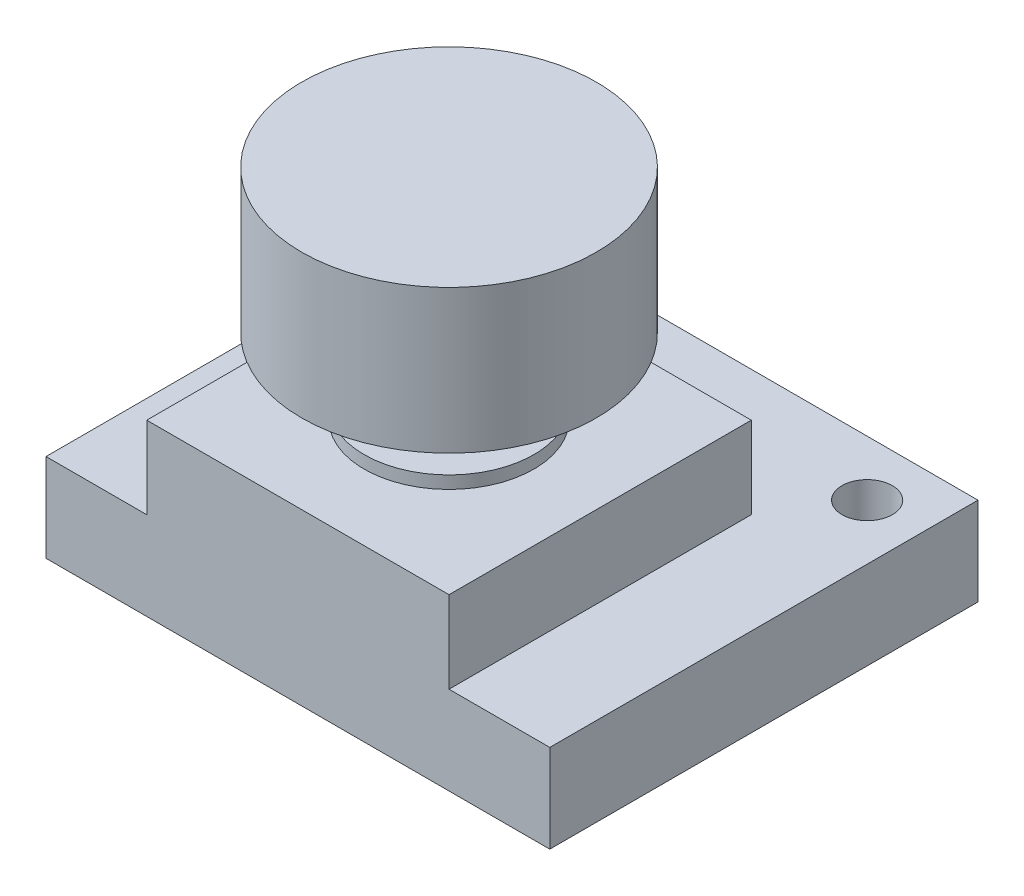
from build123d import *

# Parameters (mm, degrees)
SKETCH2_W           = 12
SKETCH2_H           = 12
BOSS_EXTRUDE1_DEPTH = 3.25
SKETCH3_R           = 3.37
SKETCH3_W           = 3
SKETCH3_H           = 3
BOSS_EXTRUDE2_DEPTH = 0.5
SKETCH3_4_W         = 3
SKETCH3_4_H         = 3
BOSS_EXTRUDE3_DEPTH = 4
BOSS_EXTRUDE4_START = 2
SKETCH3_5_W         = 3.8
SKETCH3_5_H         = 3.8
SKETCH3_5_W_2       = 3
SKETCH3_5_H_2       = 3
BOSS_EXTRUDE4_DEPTH = 2
SKETCH4_W           = 20
SKETCH4_H           = 17
SKETCH4_R           = 1
BOSS_EXTRUDE5_DEPTH = 3.5
BOSS_EXTRUDE6_START = 3
SKETCH7_R           = 5.85
BOSS_EXTRUDE6_DEPTH = 5.7


with BuildPart() as part:
    # Sketch2 → Boss-Extrude1 (new body)
    with BuildSketch(Plane(origin=(0, 0, 0), x_dir=(1, 0, 0), z_dir=(0, 1, 0))):
        Rectangle(SKETCH2_W, SKETCH2_H)
    extrude(amount=BOSS_EXTRUDE1_DEPTH)

    # Sketch3 → Boss-Extrude2 (add)
    with BuildSketch(Plane(origin=(0, 3.25, 0), x_dir=(1, 0, 0), z_dir=(0, 1, 0))):
        Circle(SKETCH3_R)
        Rectangle(SKETCH3_W, SKETCH3_H, mode=Mode.SUBTRACT)
    extrude(amount=BOSS_EXTRUDE2_DEPTH)

    # Sketch3<4> → Boss-Extrude3 (add)
    with BuildSketch(Plane(origin=(0, 3.25, 0), x_dir=(1, 0, 0), z_dir=(0, 1, 0))):
        Rectangle(SKETCH3_4_W, SKETCH3_4_H)
    extrude(amount=BOSS_EXTRUDE3_DEPTH)

    # Sketch3<5> → Boss-Extrude4 (add)
    with BuildSketch(Plane(origin=(0, 3.25, 0), x_dir=(1, 0, 0), z_dir=(0, 1, 0)).offset(BOSS_EXTRUDE4_START)):
        Rectangle(SKETCH3_5_W, SKETCH3_5_H)
        Rectangle(SKETCH3_5_W_2, SKETCH3_5_H_2, mode=Mode.SUBTRACT)
    extrude(amount=BOSS_EXTRUDE4_DEPTH)

    # Sketch4 → Boss-Extrude5 (add)
    with BuildSketch(Plane.XZ):
        with Locations((0, -2.5)):
            Rectangle(SKETCH4_W, SKETCH4_H)
        with Locations((-7.8, -8.8)):
            Circle(SKETCH4_R, mode=Mode.SUBTRACT)
        with Locations((7.8, -8.8)):
            Circle(SKETCH4_R, mode=Mode.SUBTRACT)
    extrude(amount=BOSS_EXTRUDE5_DEPTH)

    # Sketch7 → Boss-Extrude6 (add)
    with BuildSketch(Plane(origin=(0, 3.25, 0), x_dir=(1, 0, 0), z_dir=(0, 1, 0)).offset(BOSS_EXTRUDE6_START)):
        Circle(SKETCH7_R)
    extrude(amount=BOSS_EXTRUDE6_DEPTH)


solid = part.part
